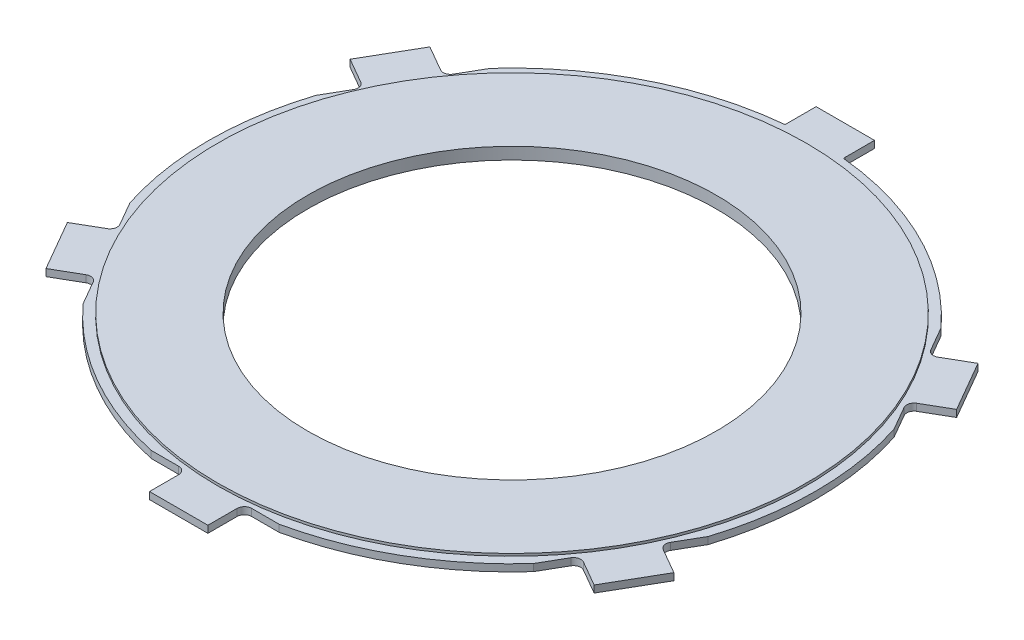
from build123d import *

# Parameters (mm, degrees)
SKETCH1_R                = 62.4
SKETCH1_R_2              = 42
BOSS_EXTRUDE1_DEPTH      = 0.725
BOSS_EXTRUDE2_DEPTH      = 0.725
CUT_EXTRUDE2_DEPTH       = 93.663561474
FILLET1_R                = 1.5
CIRPATTERN1_COUNT        = 6
FILLET1_OF_CIRPATTERN1_R = 1.5
BOSS_EXTRUDE3_START      = 0.725
SKETCH5_R                = 60.5
SKETCH5_R_2              = 42
BOSS_EXTRUDE3_DEPTH      = 0.5
BOSS_EXTRUDE5_START      = -1.225
SKETCH5_4_R              = 60.5
SKETCH5_4_R_2            = 42
BOSS_EXTRUDE5_DEPTH      = 0.5


with BuildPart() as part:
    # Sketch1 → Boss-Extrude1 (new, symmetric)
    with BuildSketch(Plane(origin=(0, 0, 0), x_dir=(1, 0, 0), z_dir=(0, 1, 0))):
        with Locations(Location((0, 0, 0), (0, 0, 270))):
            Circle(SKETCH1_R)
        with Locations(Location((0, 0, 0), (0, 0, 270))):
            Circle(SKETCH1_R_2, mode=Mode.SUBTRACT)
    boss_extrude1 = extrude(amount=BOSS_EXTRUDE1_DEPTH, both=True)

    # Sketch2 → Boss-Extrude2 (add, symmetric)
    with BuildSketch(Plane(origin=(0, 0, 0), x_dir=(1, 0, 0), z_dir=(0, 1, 0))):
        with BuildLine():
            Line((-6, 68.5), (6, 68.5))
            Line((6, 68.5), (6, 62.110868614))
            ThreePointArc((6, 62.110868614), (0, 62.4), (-6, 62.110868614))
            Line((-6, 62.110868614), (-6, 68.5))
        make_face()
    boss_extrude2 = extrude(amount=BOSS_EXTRUDE2_DEPTH, both=True)

    # Sketch4 → Cut-Extrude2 (cut, symmetric)
    with BuildSketch(Plane(origin=(0, 0, 0), x_dir=(1, 0, 0), z_dir=(0, 1, 0))):
        with BuildLine():
            ThreePointArc((-6, 62.110868614), (-9.588011618, 61.658981772), (-13.143819841, 61))
            Line((-13.143819841, 61), (-6, 61))
            Line((-6, 61), (-6, 62.110868614))
        make_face()
        with BuildLine():
            Line((6, 61), (13.143819841, 61))
            ThreePointArc((13.143819841, 61), (9.588011618, 61.658981772), (6, 62.110868614))
            Line((6, 62.110868614), (6, 61))
        make_face()
    cut_extrude2 = extrude(amount=CUT_EXTRUDE2_DEPTH, both=True, mode=Mode.SUBTRACT)

    # Fillet1
    fillet1_edges = [part.edges().sort_by_distance(p)[0] for p in [
        (-6, 0, -61),
        (6, 0, -61),
    ]]
    fillet(fillet1_edges, radius=FILLET1_R)

    # CirPattern1: Boss-Extrude1, Boss-Extrude2, Cut-Extrude2 ×6 about axis
    cirpattern1_axis = Axis((0, 0, 0), (0, 1, 0))
    add([boss_extrude1.rotate(cirpattern1_axis, i * 360 / CIRPATTERN1_COUNT) for i in range(1, CIRPATTERN1_COUNT)])
    add([boss_extrude2.rotate(cirpattern1_axis, i * 360 / CIRPATTERN1_COUNT) for i in range(1, CIRPATTERN1_COUNT)])
    add([cut_extrude2.rotate(cirpattern1_axis, i * 360 / CIRPATTERN1_COUNT) for i in range(1, CIRPATTERN1_COUNT)], mode=Mode.SUBTRACT)

    # Fillet1 of CirPattern1
    fillet1_of_cirpattern1_edges = [part.edges().sort_by_distance(p)[0] for p in [
        (-55.827549631, 0, -25.303847577),
        (-49.827549631, 0, -35.696152423),
        (-49.827549631, 0, 35.696152423),
        (-55.827549631, 0, 25.303847577),
        (6, 0, 61),
        (-6, 0, 61),
        (55.827549631, 0, 25.303847577),
        (49.827549631, 0, 35.696152423),
        (49.827549631, 0, -35.696152423),
        (55.827549631, 0, -25.303847577),
    ]]
    fillet(fillet1_of_cirpattern1_edges, radius=FILLET1_OF_CIRPATTERN1_R)

    # Sketch5 → Boss-Extrude3 (add)
    with BuildSketch(Plane(origin=(0, 0, 0), x_dir=(1, 0, 0), z_dir=(0, 1, 0)).offset(BOSS_EXTRUDE3_START)):
        with Locations(Location((0, 0, 0), (0, 0, 270))):
            Circle(SKETCH5_R)
        with Locations(Location((0, 0, 0), (0, 0, 270))):
            Circle(SKETCH5_R_2, mode=Mode.SUBTRACT)
    extrude(amount=BOSS_EXTRUDE3_DEPTH)

    # Sketch5<4> → Boss-Extrude5 (add)
    with BuildSketch(Plane(origin=(0, 0, 0), x_dir=(1, 0, 0), z_dir=(0, 1, 0)).offset(BOSS_EXTRUDE5_START)):
        with Locations(Location((0, 0, 0), (0, 0, 270))):
            Circle(SKETCH5_4_R)
        with Locations(Location((0, 0, 0), (0, 0, 270))):
            Circle(SKETCH5_4_R_2, mode=Mode.SUBTRACT)
    extrude(amount=BOSS_EXTRUDE5_DEPTH)


solid = part.part
